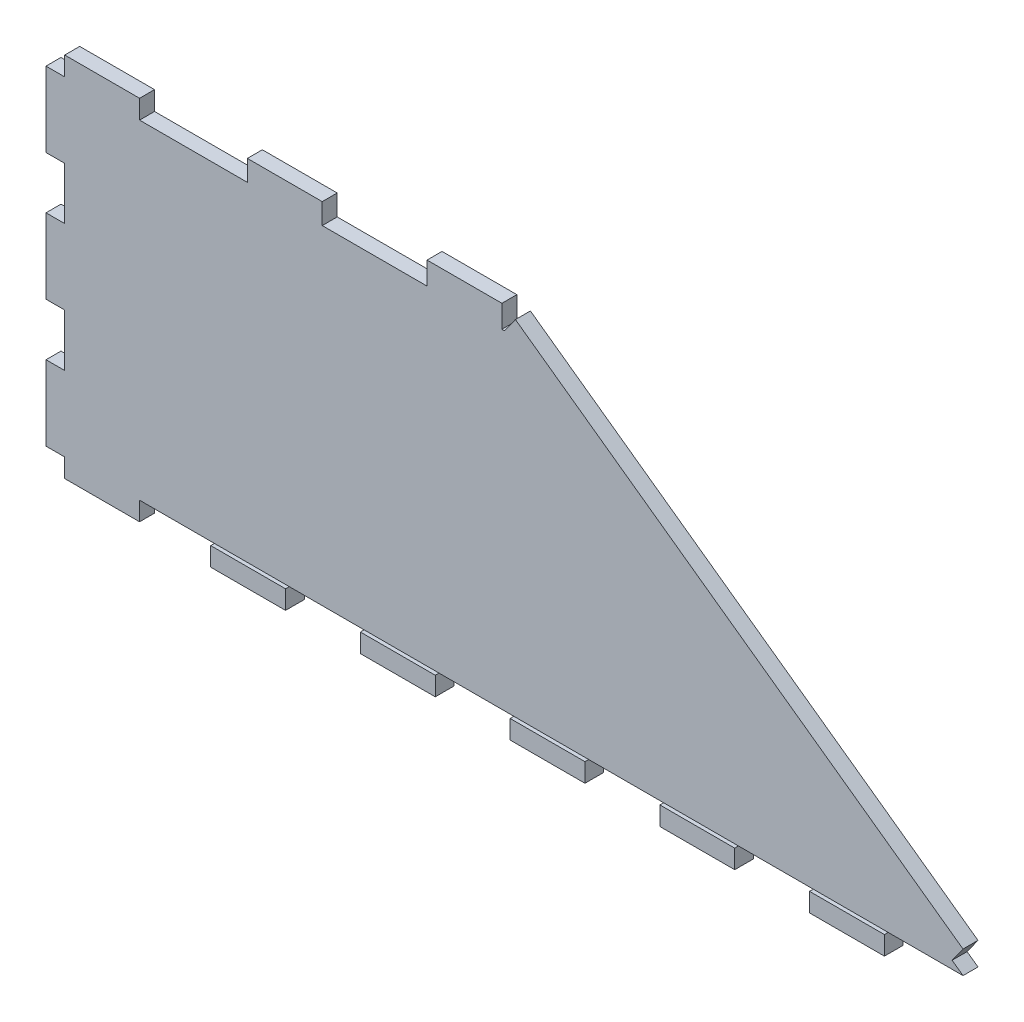
from build123d import *

# Parameters (mm, degrees)
BOSS_EXTRUDE1_DEPTH = 5.08
SKETCH1_4_W         = 25.4
SKETCH1_4_H         = 6.35
BOSS_EXTRUDE2_DEPTH = 6.35
SKETCH1_5_W         = 25.4
SKETCH1_5_H         = 6.35
BOSS_EXTRUDE3_DEPTH = 6.35


with BuildPart() as part:
    # Sketch1 → Boss-Extrude1 (new body)
    with BuildSketch(Plane(origin=(-5.329574036, -16.20301374, 0), x_dir=(1, 0, 0), z_dir=(0, 0, 1))):
        Polygon((-288.637525151, -47.206627274), (-294.987525151, -47.206627274), (-294.987525151, -72.606627274), (-288.637525151, -72.606627274), (-288.637525151, -90.311124316), (-294.987525151, -90.311124316), (-294.987525151, -115.711124316), (-288.637525151, -115.711124316), (-288.637525151, -133.491124316), (-294.987525151, -133.491124316), (-294.987525151, -158.891124316), (-288.637525151, -158.891124316), (-288.637525151, -165.241124316), (-263.237525151, -165.241124316), (-263.237525151, -158.891124316), (16.162474849, -158.891124316), (12.459338773, -156.232709467), (16.162474849, -151.074290795), (-135.709389075, -42.048208602), (-139.412525151, -47.206627274), (-140.301525151, -47.206627274), (-140.301525151, -39.558279266), (-165.701525151, -39.558279266), (-165.701525151, -47.206627274), (-201.261525151, -47.206627274), (-201.261525151, -40.164648712), (-226.661525151, -40.164648712), (-226.661525151, -47.206627274), (-263.237525151, -47.206627274), (-263.237525151, -40.781124316), (-288.637525151, -40.781124316), align=None)
    extrude(amount=BOSS_EXTRUDE1_DEPTH)

    # Sketch1<4> → Boss-Extrude2 (add)
    with BuildSketch(Plane(origin=(-5.329574036, -16.20301374, 0), x_dir=(1, 0, 0), z_dir=(0, 0, 1))):
        with Locations((-225.137525151, -162.066124316)):
            Rectangle(SKETCH1_4_W, SKETCH1_4_H)
        with Locations((-174.337525151, -162.066124316)):
            Rectangle(SKETCH1_4_W, SKETCH1_4_H)
        with Locations((-123.537525151, -162.066124316)):
            Rectangle(SKETCH1_4_W, SKETCH1_4_H)
    extrude(amount=BOSS_EXTRUDE2_DEPTH)

    # Sketch1<5> → Boss-Extrude3 (add)
    with BuildSketch(Plane(origin=(-5.329574036, -16.20301374, 0), x_dir=(1, 0, 0), z_dir=(0, 0, 1))):
        with Locations((-21.937525151, -162.066124316)):
            Rectangle(SKETCH1_5_W, SKETCH1_5_H)
        with Locations((-72.737525151, -162.066124316)):
            Rectangle(SKETCH1_5_W, SKETCH1_5_H)
    extrude(amount=BOSS_EXTRUDE3_DEPTH)


solid = part.part
